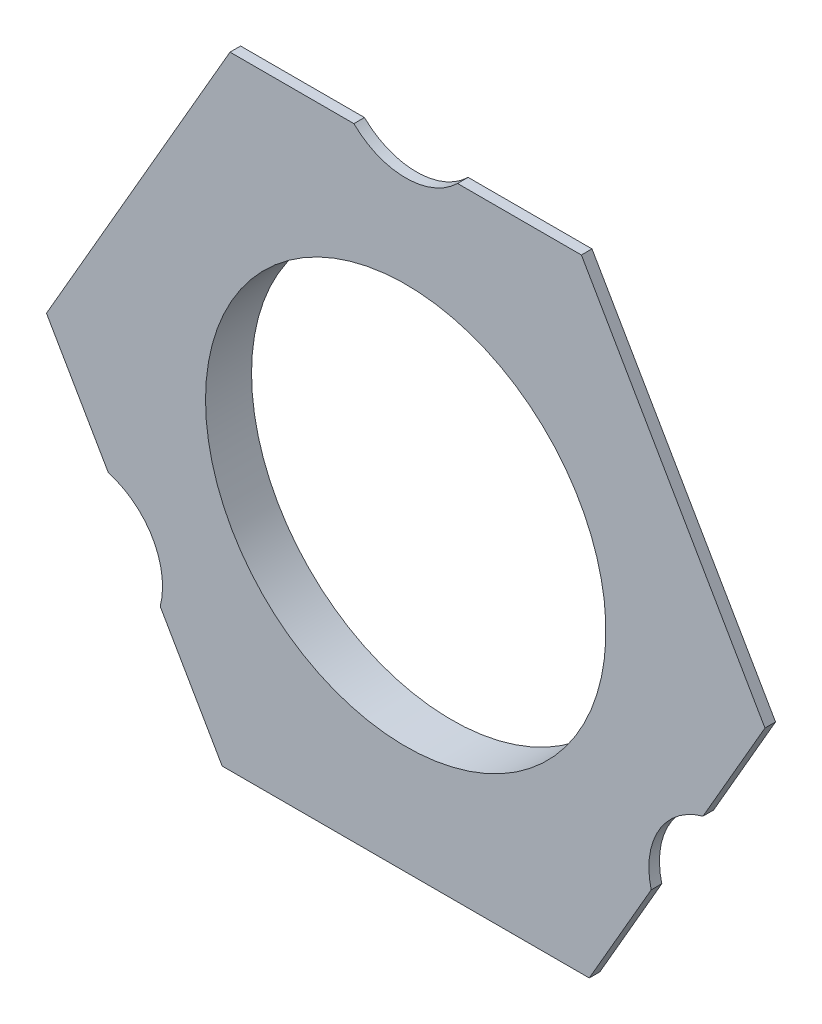
from build123d import *

# Parameters (mm, degrees)
CHAMFER1_SIZE           = 0.25
BOSS_EXTRUDE1_START     = -2
SKETCH2_R               = 44.5
BOSS_EXTRUDE1_DEPTH     = 2
CUT_EXTRUDE3_DEPTH      = 93.051684706
CUT_EXTRUDE3_DEPTH_BACK = 93.051684706
SKETCH4_W               = 115.72626858
SKETCH4_H               = 18.336467462
CHAMFER2_SIZE           = 0.25


with BuildPart() as part:
    # Sketch1 → Revolve1 (revolve)
    with BuildSketch(Plane(origin=(0, 0, 0), x_dir=(1, 0, 0), z_dir=(0, 1, 0)), mode=Mode.PRIVATE) as revolve1_sk:
        Polygon((37.85, 0), (37.85, -18.7), (44.5, -18.7), (44.5, -16.2), (43.5, -16.2), (43.5, -11.2), (44.5, -11.2), (44.5, -8.7), (55.25, -8.7), (55.25, -6.7), (39.85, -6.7), (39.85, 0), align=None)
    revolve(revolve1_sk.sketch.rotate(Axis((0, 0, -73.981367368), (0, 0, 1)), 180), axis=Axis((0, 0, -73.981367368), (0, 0, 1)))

    # Chamfer1
    chamfer1_edges = [part.edges().sort_by_distance(p)[0] for p in [
        (44.5, 0, 11.2),
        (43.5, 0, 11.2),
        (43.5, 0, 16.2),
        (44.5, 0, 16.2),
    ]]
    chamfer(chamfer1_edges, length=CHAMFER1_SIZE)

    # Sketch2 → Boss-Extrude1 (add)
    with BuildSketch(Plane.XY.offset(8.7).offset(BOSS_EXTRUDE1_START)):
        with BuildLine():
            Line((9.797958971, 59.25), (33.217958971, 59.25))
            Line((33.217958971, 59.25), (67.92098466, -0.857403669))
            Line((67.92098466, -0.857403669), (56.21098466, -21.139718626))
            ThreePointArc((56.21098466, -21.139718626), (47.847903559, -27.625), (46.413025689, -38.110281374))
            Line((46.413025689, -38.110281374), (34.703025689, -58.392596331))
            Line((34.703025689, -58.392596331), (-34.703025689, -58.392596331))
            Line((-34.703025689, -58.392596331), (-46.413025689, -38.110281374))
            ThreePointArc((-46.413025689, -38.110281374), (-47.847903559, -27.625), (-56.21098466, -21.139718626))
            Line((-56.21098466, -21.139718626), (-67.92098466, -0.857403669))
            Line((-67.92098466, -0.857403669), (-33.217958971, 59.25))
            Line((-33.217958971, 59.25), (-9.797958971, 59.25))
            ThreePointArc((-9.797958971, 59.25), (0, 55.25), (9.797958971, 59.25))
        make_face()
        with Locations(Location((0, 0, 0), (0, 0, 180))):
            Circle(SKETCH2_R, mode=Mode.SUBTRACT)
    extrude(amount=BOSS_EXTRUDE1_DEPTH)

    # Sketch4 → Cut-Extrude3 (cut, two sides: drawn at the far end of the back side and taken through both)
    with BuildSketch(Plane(origin=(0, 0, 0), x_dir=(1, 0, 0), z_dir=(0, 1, 0)).offset(-CUT_EXTRUDE3_DEPTH_BACK)):
        with Locations((0.509486717, -17.868233731)):
            Rectangle(SKETCH4_W, SKETCH4_H)
    extrude(amount=CUT_EXTRUDE3_DEPTH + CUT_EXTRUDE3_DEPTH_BACK, mode=Mode.SUBTRACT)

    # Chamfer2
    chamfer2_edges = [part.edges().sort_by_distance(p)[0] for p in [
        (39.85, 0, 0),
    ]]
    chamfer(chamfer2_edges, length=CHAMFER2_SIZE)


solid = part.part
